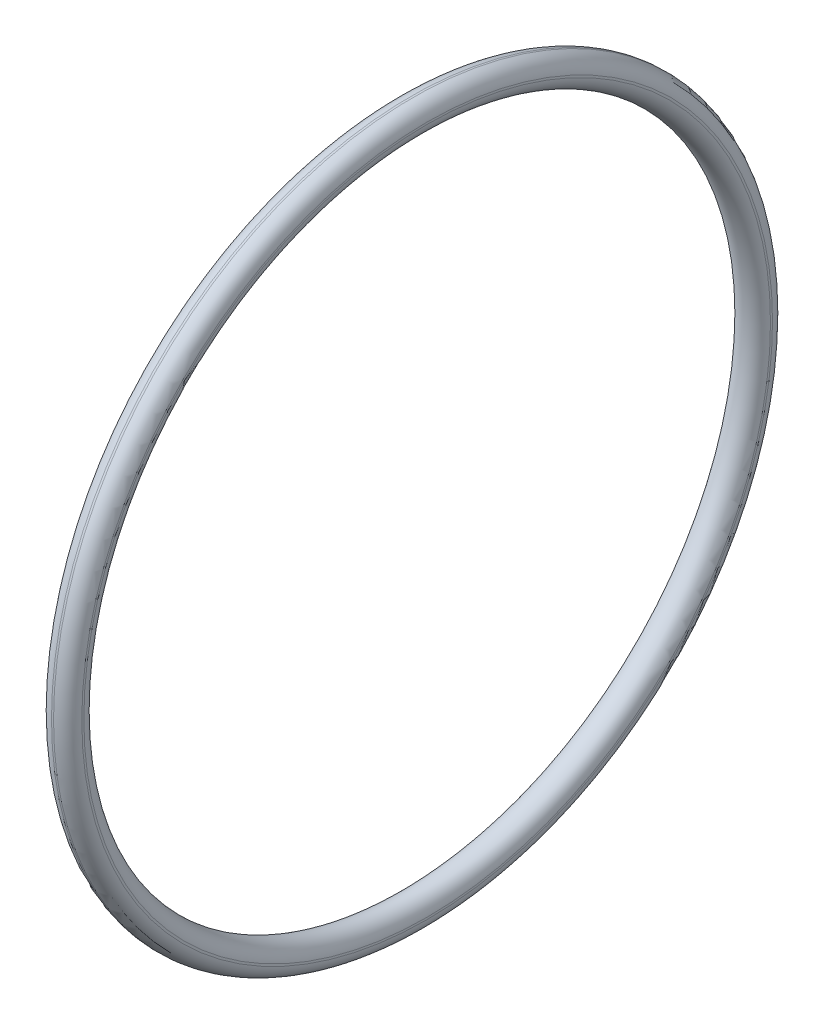
from build123d import *


with BuildPart() as part:
    # Skizze1 → Rotation1 (revolve)
    with BuildSketch(Plane.XY, mode=Mode.PRIVATE) as rotation1_sk:
        with BuildLine():
            Line((-0.1, 35.496662955), (0.1, 35.496662955))
            ThreePointArc((0.1, 35.496662955), (1.060660172, 35.060660172), (1.496662955, 34.1))
            Line((1.496662955, 34.1), (1.496662955, 33.9))
            ThreePointArc((1.496662955, 33.9), (-1.060660172, 32.939339828), (-0.1, 35.496662955))
        make_face()
    revolve(rotation1_sk.sketch.rotate(Axis((0, 0, 0), (1, 0, 0)), 90), axis=Axis((0, 0, 0), (1, 0, 0)))


solid = part.part
